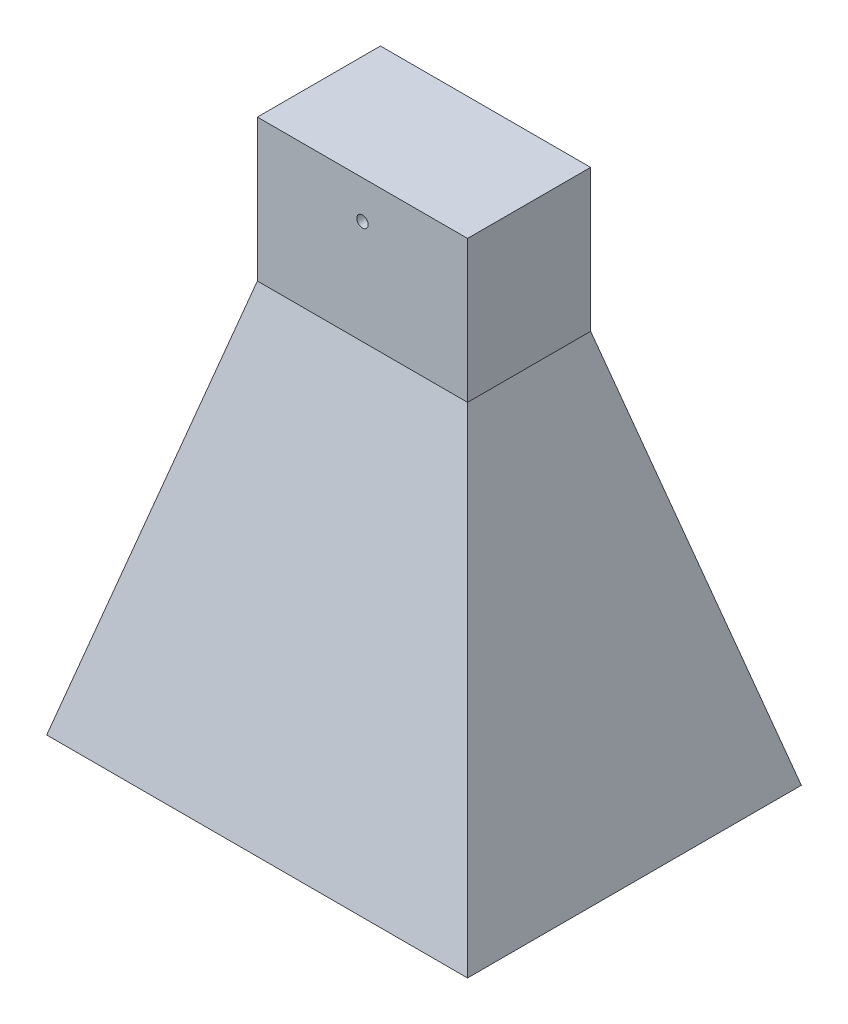
from build123d import *

# Parameters (mm, degrees)
SKETCH1_W           = 744
SKETCH1_H           = 590
BOSS_EXTRUDE1_DEPTH = 695
BOSS_EXTRUDE1_TAPER = 15
SKETCH6_W           = 734
SKETCH6_H           = 580
CUT_EXTRUDE3_DEPTH  = 784
CUT_EXTRUDE3_DRAFT  = -15
SKETCH7_W           = 371.55062252
SKETCH7_H           = 217.55062252
BOSS_EXTRUDE2_DEPTH = 251
SKETCH8_R           = 10
CUT_EXTRUDE4_DEPTH  = 100


with BuildPart() as part:
    # Sketch1 → Boss-Extrude1 (new body)
    with BuildSketch(Plane(origin=(0, 0, 0), x_dir=(1, 0, 0), z_dir=(0, 1, 0))):
        with Locations((372, 295)):
            Rectangle(SKETCH1_W, SKETCH1_H)
    extrude(amount=BOSS_EXTRUDE1_DEPTH, taper=BOSS_EXTRUDE1_TAPER)


with BuildPart() as cut_extrude3_tool:
    # Sketch6 → Cut-Extrude3 (with draft: the straight prism first)
    with BuildSketch(Plane.XZ):
        with Locations((372, -295)):
            Rectangle(SKETCH6_W, SKETCH6_H)
    extrude(amount=-CUT_EXTRUDE3_DEPTH)
    # Cut-Extrude3: the draft: its side faces are tilted about the plane it starts from
    cut_extrude3_sides = [cut_extrude3_tool.faces().sort_by_distance(p)[0] for p in [
        (372, 392, -585),
        (739, 392, -295),
        (372, 392, -5),
        (5, 392, -295),
    ]]
    draft(cut_extrude3_sides, Plane.XZ, CUT_EXTRUDE3_DRAFT)


with BuildPart() as part_1:
    add(part.part)

    # Cut-Extrude3: cut by cut_extrude3_tool
    add(cut_extrude3_tool.part, mode=Mode.SUBTRACT)

    # Sketch7 → Boss-Extrude2 (add)
    with BuildSketch(Plane(origin=(0, 695, 0), x_dir=(1, 0, 0), z_dir=(0, 1, 0))):
        with Locations((372, 295)):
            Rectangle(SKETCH7_W, SKETCH7_H)
    extrude(amount=BOSS_EXTRUDE2_DEPTH)

    # Sketch8 → Cut-Extrude4 (cut)
    with BuildSketch(Plane.XY.offset(-186.22468874)):
        with Locations((372, 879)):
            Circle(SKETCH8_R)
    extrude(amount=-CUT_EXTRUDE4_DEPTH, mode=Mode.SUBTRACT)


solid = part_1.part
